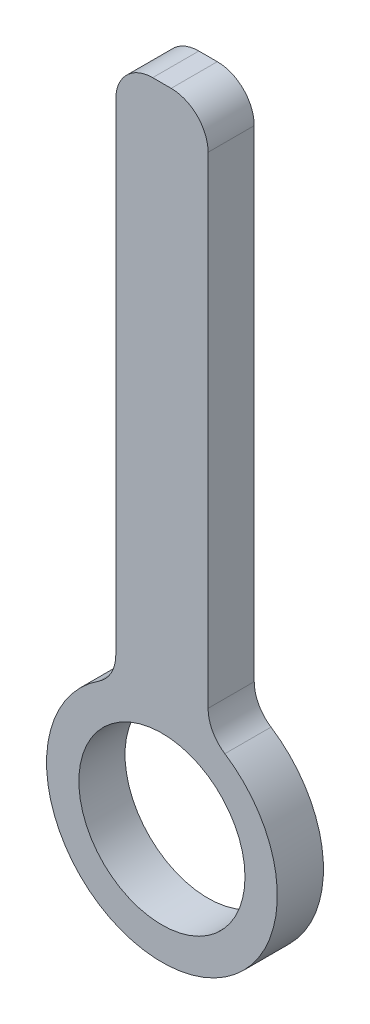
from build123d import *

# Parameters (mm, degrees)
SKETCH1_R           = 9
BOSS_EXTRUDE1_DEPTH = 2.5


with BuildPart() as part:
    # Sketch1 → Boss-Extrude1 (new, symmetric)
    with BuildSketch(Plane.XY):
        with BuildLine():
            Line((-5, 13.829316686), (-5, 66))
            ThreePointArc((-5, 66), (-3.828427125, 68.828427125), (-1, 70))
            Line((-1, 70), (1, 70))
            ThreePointArc((1, 70), (3.828427125, 68.828427125), (5, 66))
            Line((5, 66), (5, 13.829316686))
            ThreePointArc((5, 13.829316686), (5.483803708, 11.922391507), (6.818181818, 10.476755065))
            ThreePointArc((6.818181818, 10.476755065), (0, -12.5), (-6.818181818, 10.476755065))
            ThreePointArc((-6.818181818, 10.476755065), (-5.483803708, 11.922391507), (-5, 13.829316686))
        make_face()
        Circle(SKETCH1_R, mode=Mode.SUBTRACT)
    extrude(amount=BOSS_EXTRUDE1_DEPTH, both=True)


solid = part.part
